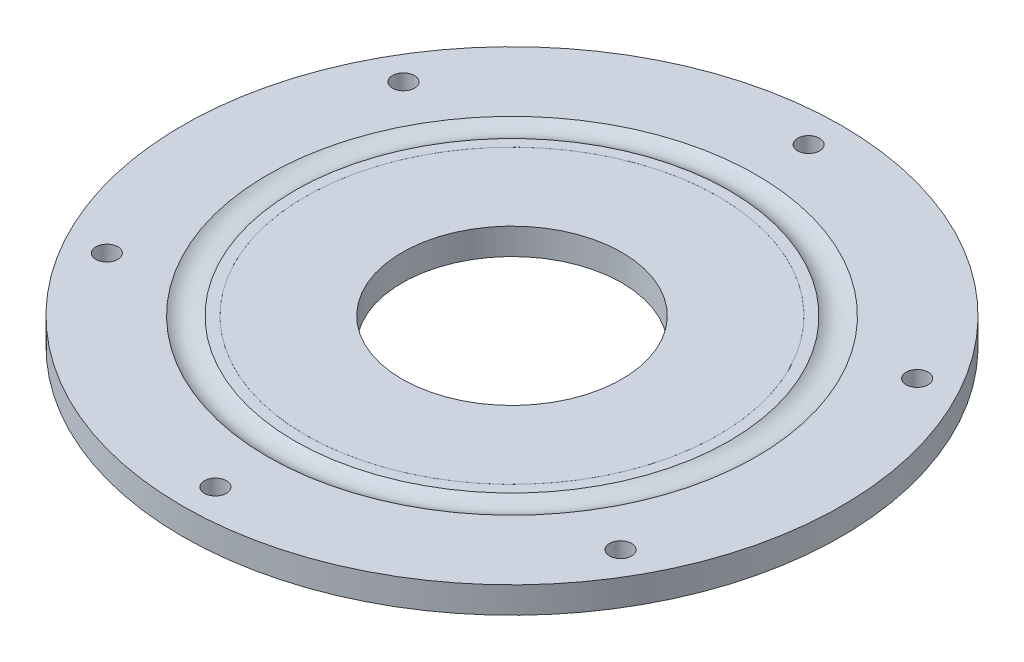
from build123d import *

# Parameters (mm, degrees)
SKETCH2_R           = 75
SKETCH2_R_2         = 59
SKETCH2_R_3         = 46.992946112
BOSS_EXTRUDE1_DEPTH = 6
SKETCH8_R           = 25
CUT_EXTRUDE4_DEPTH  = 6
SKETCH9_R           = 2.5
CUT_EXTRUDE5_DEPTH  = 10


with BuildPart() as part:
    # Sketch1 → Revolve1 (revolve)
    with BuildSketch(Plane(origin=(0, 0, 0), x_dir=(-1, 0, 0), z_dir=(0, 0, -1)), mode=Mode.PRIVATE) as revolve1_sk:
        with BuildLine():
            Line((-59, 0.8724), (-47, 0.8724))
            ThreePointArc((-47, 0.8724), (-46.292893219, 1.165293219), (-46, 1.8724))
            Line((-46, 1.8724), (-46, 5.8724))
            Line((-46, 5.8724), (-47, 6.8724))
            Line((-47, 6.8724), (-49.4043, 6.8724))
            ThreePointArc((-49.4043, 6.8724), (-52.5, 5.8405), (-55.5957, 6.8724))
            Line((-55.5957, 6.8724), (-59, 6.8724))
            Line((-59, 6.8724), (-60, 5.8724))
            Line((-60, 5.8724), (-60, 1.8724))
            ThreePointArc((-60, 1.8724), (-59.707106781, 1.165293219), (-59, 0.8724))
        make_face()
    revolve(revolve1_sk.sketch.rotate(Axis((0, 0, 0), (0, 1, 0)), 270), axis=Axis((0, 0, 0), (0, 1, 0)))

    # Sketch2 → Boss-Extrude1 (add)
    # profile 1 of 2: a face of its own
    with BuildSketch(Plane.XZ.offset(-0.8724)):
        with Locations(Location((0, 0, 0), (0, 0, 270))):
            Circle(SKETCH2_R)
        Circle(SKETCH2_R_2, mode=Mode.SUBTRACT)
    # profile 2 of 2: a face of its own
    with BuildSketch(Plane.XZ.offset(-0.8724)):
        with Locations(Location((0, 0, 0), (0, 0, 270))):
            Circle(SKETCH2_R_3)
    extrude(amount=-BOSS_EXTRUDE1_DEPTH)

    # Sketch8 → Cut-Extrude4 (cut)
    with BuildSketch(Plane(origin=(0, 6.8724, 0), x_dir=(1, 0, 0), z_dir=(0, 1, 0))):
        with Locations(Location((0, 0, 0), (0, 0, 270))):
            Circle(SKETCH8_R)
    extrude(amount=-CUT_EXTRUDE4_DEPTH, mode=Mode.SUBTRACT)

    # Sketch9 → Cut-Extrude5 (cut)
    with BuildSketch(Plane.XZ.offset(-0.8724)):
        with Locations(Location((0, 67.5, 0), (0, 0, 270))):
            Circle(SKETCH9_R)
        with Locations(Location((58.456714755, 33.75, 0), (0, 0, 270))):
            Circle(SKETCH9_R)
        with Locations(Location((58.456714755, -33.75, 0), (0, 0, 270))):
            Circle(SKETCH9_R)
        with Locations(Location((0, -67.5, 0), (0, 0, 270))):
            Circle(SKETCH9_R)
        with Locations(Location((-58.456714755, -33.75, 0), (0, 0, 270))):
            Circle(SKETCH9_R)
        with Locations(Location((-58.456714755, 33.75, 0), (0, 0, 270))):
            Circle(SKETCH9_R)
    extrude(amount=-CUT_EXTRUDE5_DEPTH, mode=Mode.SUBTRACT)


solid = part.part
